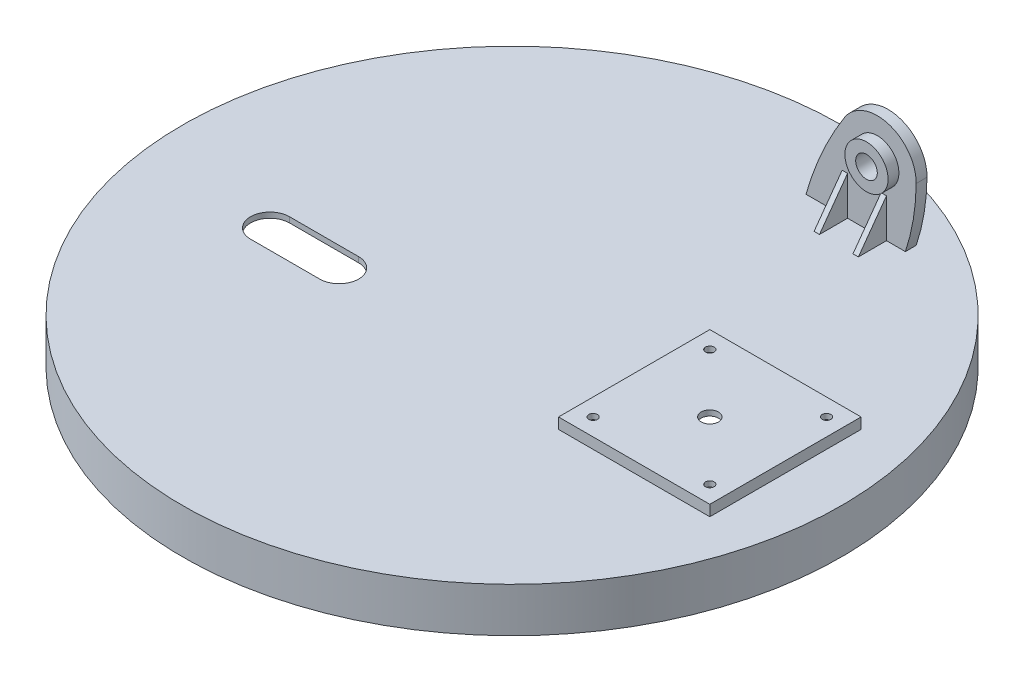
from build123d import *

# Parameters (mm, degrees)
SKETCH_1_R           = 305
EXTRUDE_1_DEPTH      = 41.2
SKETCH_4_W           = 140
SKETCH_4_H           = 140
EXTRUDE_2_DEPTH      = 10
SHELL_1_T            = -5
CUT_EXTRUDE_3_DEPTH  = 434.298326791
SKETCH_5_R           = 8
SKETCH_5_R_2         = 4
CUT_EXTRUDE_6_DEPTH  = 435.363258115
SKETCH_11_W          = 130
SKETCH_11_H          = 10
EXTRUDE_3_DEPTH      = 200
CUT_EXTRUDE_8_DEPTH  = 664.812051713
SKETCH_14_R          = 20
EXTRUDE_4_DEPTH      = 10
SKETCH_16_R          = 10
CUT_EXTRUDE_10_DEPTH = 626.006271969
SKETCH_19_W          = 5
SKETCH_19_H          = 36
EXTRUDE_5_DEPTH      = 26
CUT_EXTRUDE_11_DEPTH = 536.715493522
SKETCH_21_W          = 19
SKETCH_21_H          = 5
SKETCH_21_W_2        = 5
SKETCH_21_H_2        = 51.5


with BuildPart() as part:
    # 草图1 → 凸台-拉伸1 (new body)
    with BuildSketch(Plane(origin=(0, 0, 0), x_dir=(1, 0, 0), z_dir=(0, 1, 0))):
        with Locations(Location((0, 0, 0), (0, 0, 90))):
            Circle(SKETCH_1_R)
    extrude(amount=EXTRUDE_1_DEPTH)

    # 草图4 → 凸台-拉伸2 (add)
    with BuildSketch(Plane(origin=(0, 41.2, 0), x_dir=(1, 0, 0), z_dir=(0, 1, 0))):
        with Locations((183, 0)):
            Rectangle(SKETCH_4_W, SKETCH_4_H)
    extrude(amount=EXTRUDE_2_DEPTH)

    # 抽壳1
    shell_1_openings = [part.faces().sort_by_distance(p)[0] for p in [
        (0, 0, 0),
    ]]
    offset(amount=SHELL_1_T, openings=shell_1_openings, kind=Kind.INTERSECTION)

    # 草图2 → 切除-拉伸3 (cut, through all)
    with BuildSketch(Plane(origin=(0, 41.2, 0), x_dir=(1, 0, 0), z_dir=(0, 1, 0))):
        with BuildLine():
            Line((-182, -24), (-118, -24))
            ThreePointArc((-118, -24), (-100, -42), (-118, -60))
            Line((-118, -60), (-182, -60))
            ThreePointArc((-182, -60), (-200, -42), (-182, -24))
        make_face()
    extrude(amount=-CUT_EXTRUDE_3_DEPTH, mode=Mode.SUBTRACT)

    # 草图5 → 切除-拉伸6 (cut, through all)
    with BuildSketch(Plane(origin=(0, 51.2, 0), x_dir=(1, 0, 0), z_dir=(0, 1, 0))):
        with Locations(Location((183, 0, 0), (0, 0, 270))):
            Circle(SKETCH_5_R)
        with Locations(Location((129, 54, 0), (0, 0, 270))):
            Circle(SKETCH_5_R_2)
        with Locations(Location((237, 54, 0), (0, 0, 270))):
            Circle(SKETCH_5_R_2)
        with Locations(Location((237, -54, 0), (0, 0, 270))):
            Circle(SKETCH_5_R_2)
        with Locations(Location((129, -54, 0), (0, 0, 270))):
            Circle(SKETCH_5_R_2)
    extrude(amount=-CUT_EXTRUDE_6_DEPTH, mode=Mode.SUBTRACT)

    # 草图11 → 凸台-拉伸3 (add)
    with BuildSketch(Plane(origin=(0, 41.2, 0), x_dir=(1, 0, 0), z_dir=(0, 1, 0))):
        with Locations((104, 238)):
            Rectangle(SKETCH_11_W, SKETCH_11_H)
    extrude(amount=EXTRUDE_3_DEPTH)

    # 草图13 → 切除-拉伸8 (cut, through all)
    with BuildSketch(Plane.XY.offset(-233)):
        with BuildLine():
            Line((39, 41.2), (39, 241.2))
            Line((39, 241.2), (169, 241.2))
            Line((169, 241.2), (169, 41.2))
            Line((169, 41.2), (131, 41.2))
            ThreePointArc((131, 41.2), (138.32356193, 70.621084147), (140.99801314, 100.821780537))
            ThreePointArc((140.99801314, 100.821780537), (115.26317996, 135.706044936), (74.646786984, 120.556716136))
            ThreePointArc((74.646786984, 120.556716136), (53.931588882, 82.177347592), (39, 41.2))
        make_face()
    extrude(amount=-CUT_EXTRUDE_8_DEPTH, mode=Mode.SUBTRACT)

    # 草图14 → 凸台-拉伸4 (add)
    with BuildSketch(Plane.XY.offset(-233)):
        with Locations(Location((105, 101.2, 0), (0, 0, 180))):
            Circle(SKETCH_14_R)
    extrude(amount=EXTRUDE_4_DEPTH)

    # 草图16 → 切除-拉伸10 (cut, through all)
    with BuildSketch(Plane.XY.offset(-223)):
        with Locations((105, 101.2)):
            Circle(SKETCH_16_R)
    extrude(amount=-CUT_EXTRUDE_10_DEPTH, mode=Mode.SUBTRACT)

    # 草图19 → 凸台-拉伸5 (add)
    with BuildSketch(Plane.XY.offset(-233)):
        with Locations((75, 59.2)):
            Rectangle(SKETCH_19_W, SKETCH_19_H)
        with Locations((111, 59.2)):
            Rectangle(SKETCH_19_W, SKETCH_19_H)
    extrude(amount=EXTRUDE_5_DEPTH)

    # 草图20 → 切除-拉伸11 (cut, through all)
    with BuildSketch(Plane(origin=(113.5, 0, 0), x_dir=(0, 0, -1), z_dir=(1, 0, 0))):
        Polygon((233, 77.2), (207, 41.2), (207, 77.2), align=None)
    extrude(amount=-CUT_EXTRUDE_11_DEPTH, mode=Mode.SUBTRACT)

    # 草图21 → 旋转2 (revolve)
    with BuildSketch(Plane.XY, mode=Mode.PRIVATE) as revolve_2_sk:
        with Locations((-65.5, 33.7)):
            Rectangle(SKETCH_21_W, SKETCH_21_H)
        with Locations((-82.5, 10.45)):
            Rectangle(SKETCH_21_W_2, SKETCH_21_H_2)
    revolve(revolve_2_sk.sketch.rotate(Axis((0, 0, 0), (0, -1, 0)), 270), axis=Axis((0, 0, 0), (0, -1, 0)))


solid = part.part
